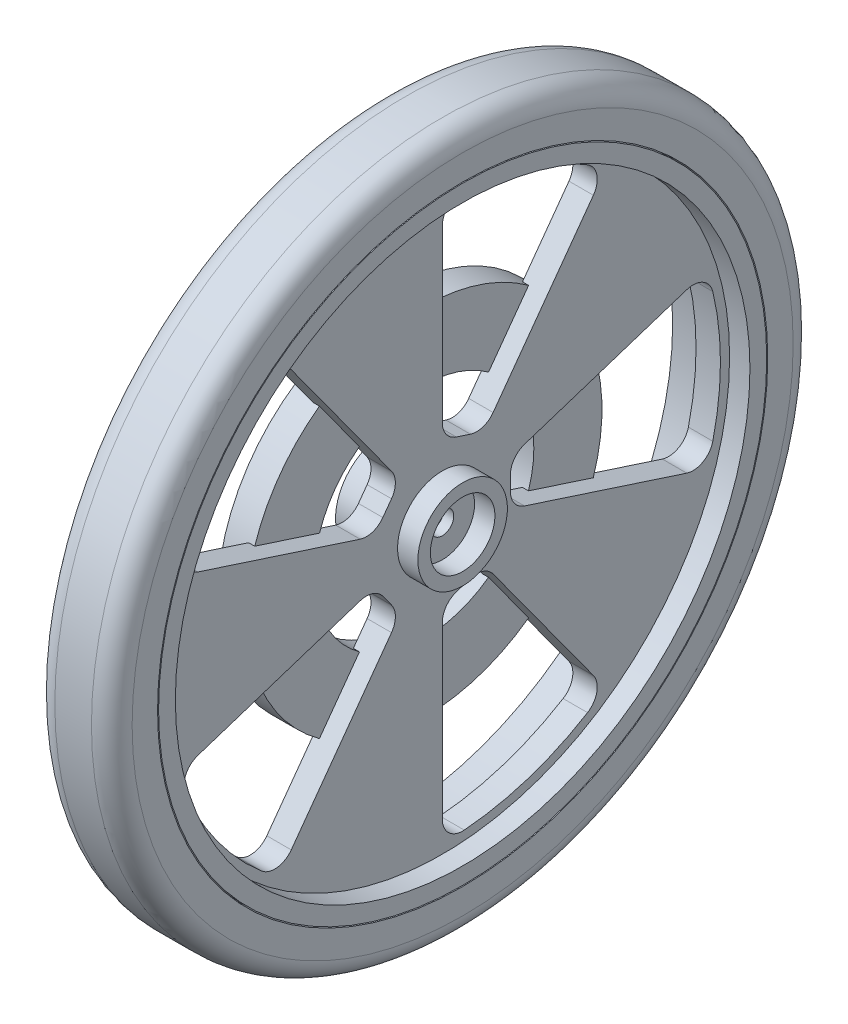
from build123d import *

# Parameters (mm, degrees)
EXTRUDE1_DEPTH           = 20
FILLET1_R                = 2
CIRPATTERN1_COUNT        = 5
FILLET1_OF_CIRPATTERN1_R = 2
SKETCH4_R                = 28.25
EXTRUDE2_DEPTH           = 1.2
EXTRUDE3_START           = -2.4
SKETCH6_R                = 4.9
EXTRUDE3_DEPTH           = 5.6
SKETCH7_R                = 5.023387
SKETCH7_R_2              = 1.125
EXTRUDE4_DEPTH           = 1
SKETCH8_R                = 4.4
SKETCH8_R_2              = 3.175
EXTRUDE5_DEPTH           = 2
EXTRUDE6_DEPTH           = 0.2
CIRPATTERN2_COUNT        = 24


with BuildPart() as part:
    # Sketch1 → Revolve1 (revolve)
    with BuildSketch(Plane.XY, mode=Mode.PRIVATE) as revolve1_sk:
        with BuildLine():
            Line((-1.8, 34.5), (1.8, 34.5))
            ThreePointArc((1.8, 34.5), (3.214214, 33.914214), (3.8, 32.5))
            Line((3.8, 32.5), (3.8, 30))
            Line((3.8, 30), (1.8, 30))
            Line((1.8, 30), (1.8, 29.9))
            Line((1.8, 29.9), (3.8, 29.9))
            Line((3.8, 29.9), (3.8, 28.25))
            Line((3.8, 28.25), (1.8, 28.25))
            Line((1.8, 28.25), (1.8, 3.5))
            Line((1.8, 3.5), (-1.8, 3.5))
            Line((-1.8, 3.5), (-1.8, 28.25))
            Line((-1.8, 28.25), (-3.8, 28.25))
            Line((-3.8, 28.25), (-3.8, 29.9))
            Line((-3.8, 29.9), (-1.8, 29.9))
            Line((-1.8, 29.9), (-1.8, 30))
            Line((-1.8, 30), (-3.8, 30))
            Line((-3.8, 30), (-3.8, 32.5))
            ThreePointArc((-3.8, 32.5), (-3.214214, 33.914214), (-1.8, 34.5))
        make_face()
    revolve(revolve1_sk.sketch.rotate(Axis((0, 0, 0), (1, 0, 0)), 90), axis=Axis((0, 0, 0), (1, 0, 0)))

    # Sketch3 → Extrude1 (cut)
    with BuildSketch(Plane(origin=(1.8, 0, 0), x_dir=(0, 0, -1), z_dir=(1, 0, 0))):
        with BuildLine():
            Line((0, 7.044797), (0, 27.35))
            ThreePointArc((0, 27.35), (8.451615, 26.011396), (16.075927, 22.126615))
            Line((16.075927, 22.126615), (4.140828, 5.69936))
            Line((4.140828, 5.69936), (0, 7.044797))
        make_face()
    extrude1 = extrude(amount=-EXTRUDE1_DEPTH, mode=Mode.SUBTRACT)

    # Fillet1
    fillet1_edges = [part.edges().sort_by_distance(p)[0] for p in [
        (0, 5.69936, -4.140828),
        (0, 7.044797, 0),
        (0, 27.35, 0),
        (0, 22.126615, -16.075927),
    ]]
    fillet(fillet1_edges, radius=FILLET1_R)

    # CirPattern1: Extrude1 ×5 about axis
    cirpattern1_axis = Axis((0, 0, 0), (1, 0, 0))
    for i in range(1, CIRPATTERN1_COUNT):
        add(extrude1.rotate(cirpattern1_axis, i * 360 / CIRPATTERN1_COUNT), mode=Mode.SUBTRACT)

    # Fillet1 of CirPattern1
    fillet1_of_cirpattern1_edges = [part.edges().sort_by_distance(p)[0] for p in [
        (0, 5.69936, 4.140828),
        (0, 2.176962, 6.7),
        (0, 8.451615, 26.011396),
        (0, 22.126615, 16.075927),
        (0, -2.176962, 6.7),
        (0, -5.69936, 4.140828),
        (0, -22.126615, 16.075927),
        (0, -8.451615, 26.011396),
        (0, -7.044797, 0),
        (0, -5.69936, -4.140828),
        (0, -22.126615, -16.075927),
        (0, -27.35, 0),
        (0, -2.176962, -6.7),
        (0, 2.176962, -6.7),
        (0, 8.451615, -26.011396),
        (0, -8.451615, -26.011396),
    ]]
    fillet(fillet1_of_cirpattern1_edges, radius=FILLET1_OF_CIRPATTERN1_R)

    # Sketch4 → Extrude2 (cut)
    with BuildSketch(Plane.ZY.offset(1.8)):
        Circle(SKETCH4_R)
    extrude(amount=-EXTRUDE2_DEPTH, mode=Mode.SUBTRACT)

    # Sketch5 → Revolve2 (revolve)
    with BuildSketch(Plane.XY, mode=Mode.PRIVATE) as revolve2_sk:
        Polygon((-2.8, 17.5), (-2.8, 16.57), (-0.6, 16.57), (-0.6, 11.44), (-2.3, 11.44), (-2.3, 10.8), (0, 10.8), (0, 17.5), align=None)
    revolve(revolve2_sk.sketch.rotate(Axis((0, 0, 0), (1, 0, 0)), 90), axis=Axis((0, 0, 0), (1, 0, 0)))

    # Sketch6 → Extrude3 (add)
    with BuildSketch(Plane.ZY.offset(0.6).offset(EXTRUDE3_START)):
        with Locations(Location((0, 0, 0), (0, 0, 180))):
            Circle(SKETCH6_R)
        with BuildLine():
            Line((2.38, 2.566242), (2.38, -2.566242))
            ThreePointArc((2.38, -2.566242), (0, -3.5), (-2.38, -2.566242))
            Line((-2.38, -2.566242), (-2.38, 2.566242))
            ThreePointArc((-2.38, 2.566242), (0, 3.5), (2.38, 2.566242))
        make_face(mode=Mode.SUBTRACT)
    extrude(amount=EXTRUDE3_DEPTH)

    # Sketch7 → Extrude4 (add)
    with BuildSketch(Plane(origin=(1.8, 0, 0), x_dir=(0, 0, -1), z_dir=(1, 0, 0))):
        Circle(SKETCH7_R)
        Circle(SKETCH7_R_2, mode=Mode.SUBTRACT)
    extrude(amount=-EXTRUDE4_DEPTH)

    # Sketch8 → Extrude5 (add)
    with BuildSketch(Plane(origin=(1.8, 0, 0), x_dir=(0, 0, -1), z_dir=(1, 0, 0))):
        with Locations(Location((0, 0, 0), (0, 0, 180))):
            Circle(SKETCH8_R)
        with Locations(Location((0, 0, 0), (0, 0, 180))):
            Circle(SKETCH8_R_2, mode=Mode.SUBTRACT)
    extrude(amount=EXTRUDE5_DEPTH)

    # Sketch9 → Extrude6 (add)
    with BuildSketch(Plane.ZY.offset(0.6)):
        Polygon((-1.144555, 17.462531), (-0.748212, 11.415506), (0.748212, 11.415506), (1.144555, 17.462531), align=None)
    extrude6 = extrude(amount=EXTRUDE6_DEPTH)

    # CirPattern2: Extrude6 ×24 about axis
    cirpattern2_axis = Axis((0, 0, 0), (1, 0, 0))
    for i in range(1, CIRPATTERN2_COUNT):
        add(extrude6.rotate(cirpattern2_axis, i * 360 / CIRPATTERN2_COUNT))


solid = part.part
